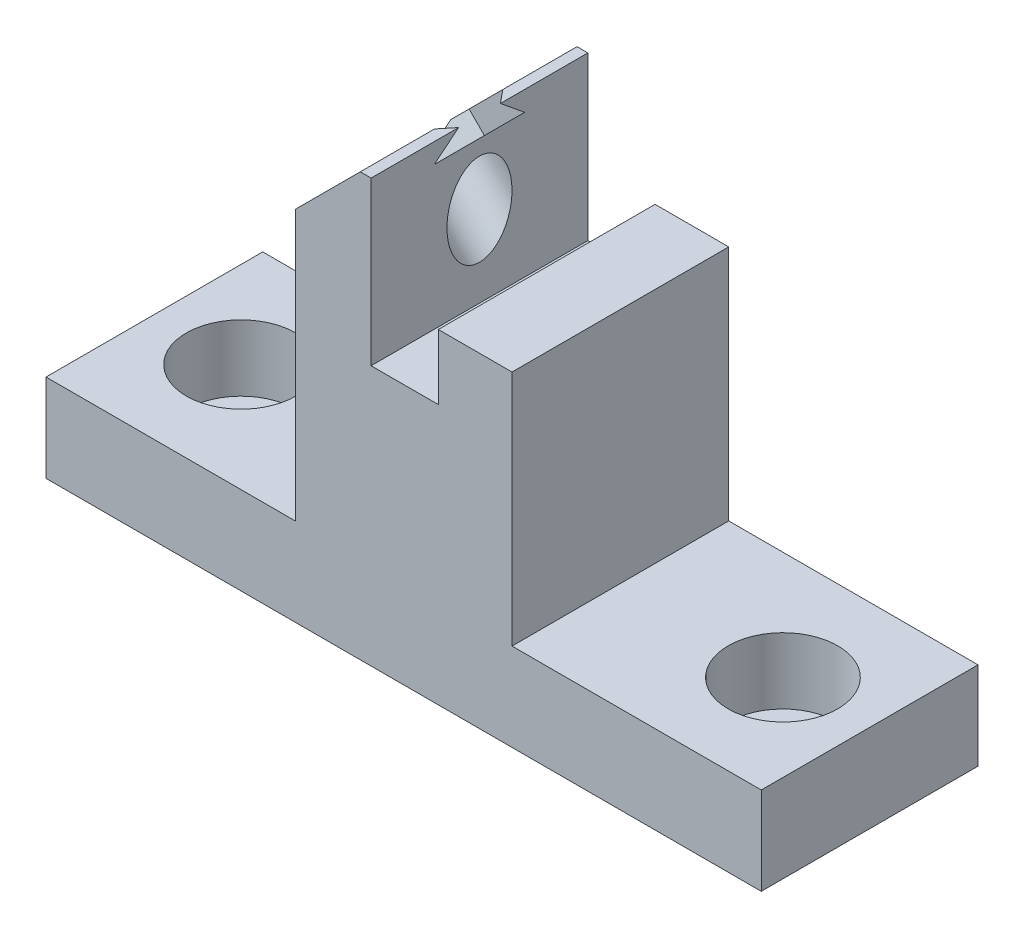
from build123d import *

# Parameters (mm, degrees)
SKETCH1_W           = 20
SKETCH1_H           = 20
BOSS_EXTRUDE1_DEPTH = 6
SKETCH2_W           = 6.8
SKETCH2_H           = 20
BOSS_EXTRUDE2_DEPTH = 6
SKETCH3_W           = 7
SKETCH3_H           = 20
BOSS_EXTRUDE3_DEPTH = 15
CHAMFER1_SIZE       = 6
SKETCH4_R           = 3
CUT_EXTRUDE1_DEPTH  = 10
SKETCH5_W           = 20
SKETCH5_H           = 20
BOSS_EXTRUDE4_DEPTH = 18
CUT_EXTRUDE2_DEPTH  = 2
SKETCH9_W           = 20
SKETCH9_H           = 8.1
BOSS_EXTRUDE5_DEPTH = 23
CUT_EXTRUDE5_REACH  = 54.058
SKETCH10_R          = 3
SKETCH11_R          = 5.05
CUT_EXTRUDE6_DEPTH  = 6.1


with BuildPart() as part:
    # Sketch1 → Boss-Extrude1 (new body)
    with BuildSketch(Plane(origin=(0, 0, 0), x_dir=(1, 0, 0), z_dir=(0, 1, 0))):
        Rectangle(SKETCH1_W, SKETCH1_H)
    extrude(amount=BOSS_EXTRUDE1_DEPTH)

    # Sketch2 → Boss-Extrude2 (add)
    with BuildSketch(Plane(origin=(0, 6, 0), x_dir=(1, 0, 0), z_dir=(0, 1, 0))):
        with Locations((6.6, 0)):
            Rectangle(SKETCH2_W, SKETCH2_H)
    extrude(amount=BOSS_EXTRUDE2_DEPTH)

    # Sketch3 → Boss-Extrude3 (add)
    with BuildSketch(Plane(origin=(0, 6, 0), x_dir=(1, 0, 0), z_dir=(0, 1, 0))):
        with Locations((-6.5, 0)):
            Rectangle(SKETCH3_W, SKETCH3_H)
    extrude(amount=BOSS_EXTRUDE3_DEPTH)

    # Chamfer1
    chamfer1_edges = [part.edges().sort_by_distance(p)[0] for p in [
        (-10, 21, 0),
    ]]
    chamfer(chamfer1_edges, length=CHAMFER1_SIZE)

    # Sketch4 → Cut-Extrude1 (cut)
    with BuildSketch(Plane(origin=(-12.5, 12.5, 0), x_dir=(0, 0, 1), z_dir=(-0.7071067811865489, 0.7071067811865462, 0))):
        with Locations(Location((0, 7.432512212, 0), (0, 0, 270))):
            Circle(SKETCH4_R)
    extrude(amount=-CUT_EXTRUDE1_DEPTH, mode=Mode.SUBTRACT)

    # Sketch5 → Boss-Extrude4 (add)
    with BuildSketch(Plane.XZ):
        Rectangle(SKETCH5_W, SKETCH5_H)
    extrude(amount=BOSS_EXTRUDE4_DEPTH)

    # Sketch6 → Cut-Extrude2 (cut)
    with BuildSketch(Plane(origin=(-12.5, 12.5, 0), x_dir=(0, 0, 1), z_dir=(-0.7071067811865489, 0.7071067811865462, 0))):
        Polygon((0, 13.8411002), (-5.55, 10.636806206), (-5.55, 4.228218218), (0, 1.023924224), (5.55, 4.228218218), (5.55, 10.636806206), align=None)
    extrude(amount=-CUT_EXTRUDE2_DEPTH, mode=Mode.SUBTRACT)

    # Sketch9 → Boss-Extrude5 (add)
    with BuildSketch(Plane(origin=(10, 0, 0), x_dir=(0, 0, -1), z_dir=(1, 0, 0))):
        with Locations((0, -13.95)):
            Rectangle(SKETCH9_W, SKETCH9_H)
    boss_extrude5 = extrude(amount=BOSS_EXTRUDE5_DEPTH)

    # Sketch10 → Cut-Extrude5 (cut, up to next)
    with BuildSketch(Plane.XZ.offset(18), mode=Mode.PRIVATE) as cut_extrude5_sk1:
        with Locations(Location((25, 0, 0), (0, 0, 270))):
            Circle(SKETCH10_R)
    cut_extrude5_tool1 = extrude(cut_extrude5_sk1.sketch, amount=-CUT_EXTRUDE5_REACH, mode=Mode.PRIVATE) & part.part
    cut_extrude5 = cut_extrude5_tool1.solids().sort_by_distance((25, -18, 0))[0]
    add(cut_extrude5, mode=Mode.SUBTRACT)

    # Sketch11 → Cut-Extrude6 (cut)
    with BuildSketch(Plane(origin=(0, -9.9, 0), x_dir=(1, 0, 0), z_dir=(0, 1, 0))):
        with Locations(Location((25, 0, 0), (0, 0, 270))):
            Circle(SKETCH11_R)
    cut_extrude6 = extrude(amount=-CUT_EXTRUDE6_DEPTH, mode=Mode.SUBTRACT)

    # Mirror1: Boss-Extrude5, Cut-Extrude5, Cut-Extrude6 across plane
    add(boss_extrude5.mirror(Plane(origin=(0, 0, 0), x_dir=(0, 0, 1), z_dir=(1, 0, 0))))
    add(cut_extrude5.mirror(Plane(origin=(0, 0, 0), x_dir=(0, 0, 1), z_dir=(1, 0, 0))), mode=Mode.SUBTRACT)
    add(cut_extrude6.mirror(Plane(origin=(0, 0, 0), x_dir=(0, 0, 1), z_dir=(1, 0, 0))), mode=Mode.SUBTRACT)


solid = part.part
